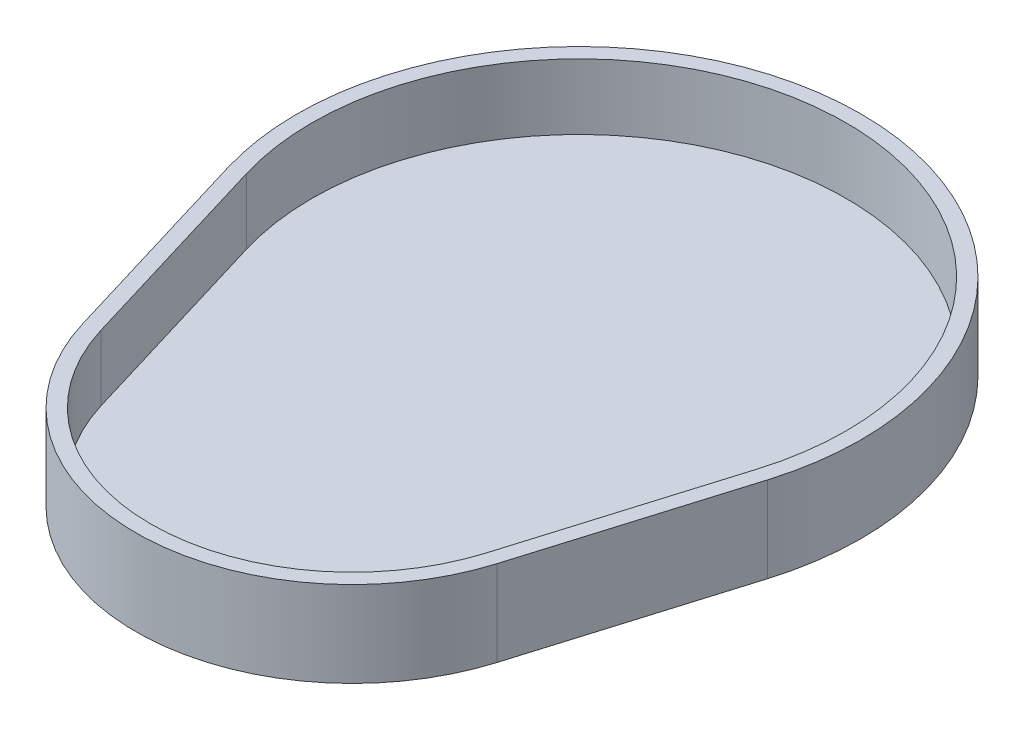
from build123d import *

# Parameters (mm, degrees)
SALIENTE_EXTRUIR1_DEPTH = 4
SALIENTE_EXTRUIR3_DEPTH = 13


with BuildPart() as part:
    # Croquis1 → Saliente-Extruir1 (new body)
    with BuildSketch(Plane(origin=(0, 0, 0), x_dir=(1, 0, 0), z_dir=(0, 1, 0))):
        with BuildLine():
            Line((-53.612307413, -2.177777778), (-41.166593192, -43.422222222))
            ThreePointArc((-41.166593192, -43.422222222), (0, -74), (41.166593192, -43.422222222))
            Line((41.166593192, -43.422222222), (53.612307413, -2.177777778))
            ThreePointArc((53.612307413, -2.177777778), (0, 70), (-53.612307413, -2.177777778))
        make_face()
    extrude(amount=SALIENTE_EXTRUIR1_DEPTH)

    # Croquis3 → Saliente-Extruir3 (add)
    with BuildSketch(Plane(origin=(0, 4, 0), x_dir=(1, 0, 0), z_dir=(0, 1, 0))):
        with BuildLine():
            Line((41.166593192, -43.422222222), (53.612307413, -2.177777778))
            ThreePointArc((53.612307413, -2.177777778), (0, 70), (-53.612307413, -2.177777778))
            Line((-53.612307413, -2.177777778), (-41.166593192, -43.422222222))
            ThreePointArc((-41.166593192, -43.422222222), (0, -74), (41.166593192, -43.422222222))
        make_face()
        with BuildLine():
            Line((38.294505295, -42.555555556), (50.740219516, -1.311111111))
            ThreePointArc((50.740219516, -1.311111111), (0, 67), (-50.740219516, -1.311111111))
            Line((-50.740219516, -1.311111111), (-38.294505295, -42.555555556))
            ThreePointArc((-38.294505295, -42.555555556), (0, -71), (38.294505295, -42.555555556))
        make_face(mode=Mode.SUBTRACT)
    extrude(amount=SALIENTE_EXTRUIR3_DEPTH)


solid = part.part
